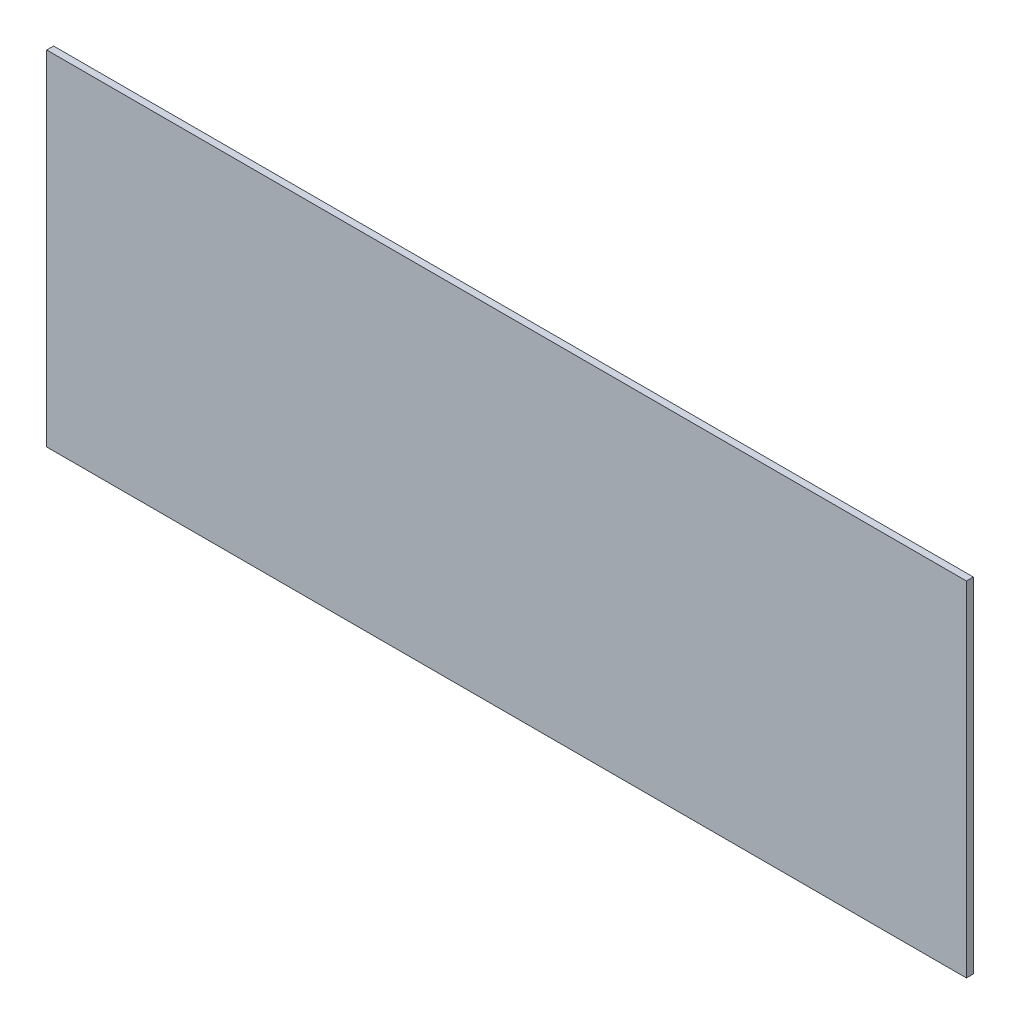
from build123d import *

# Parameters (mm, degrees)
SKICA1_W                = 535
SKICA1_H                = 200
P_IDAT_VYSUNUT_M1_DEPTH = 4


with BuildPart() as part:
    # Skica1 → Přidat vysunutím1 (new body)
    with BuildSketch(Plane.XY):
        Rectangle(SKICA1_W, SKICA1_H)
    extrude(amount=P_IDAT_VYSUNUT_M1_DEPTH)


solid = part.part
